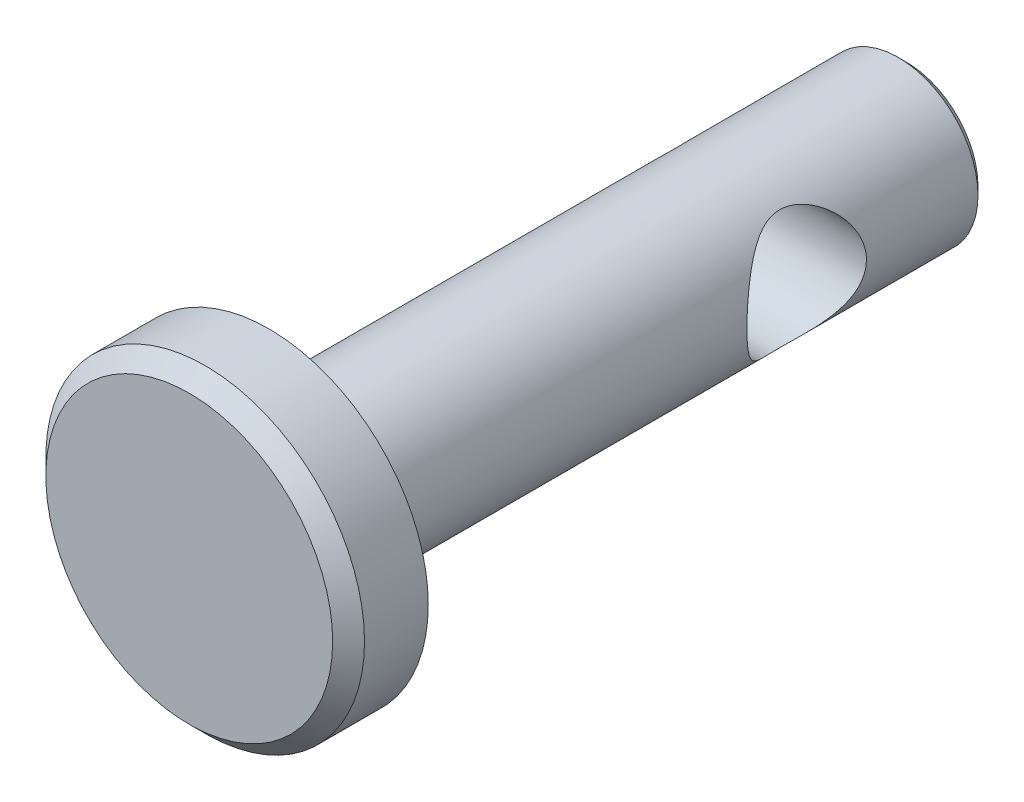
from build123d import *

# Parameters (mm, degrees)
SKETCH1_R           = 1.5875
EXTRUDE1_DEPTH      = 6.35
SKETCH2_R           = 3.175
EXTRUDE2_DEPTH      = 1.5875
CHAMFER1_SIZE       = 0.3175
EXTRUDE3_DEPTH      = 10.119493201
EXTRUDE3_DEPTH_BACK = 10.119493201
SKETCH3_R           = 1.190625
CHAMFER2_SIZE       = 0.15875


with BuildPart() as part:
    # Sketch1 → Extrude1 (new, symmetric)
    with BuildSketch(Plane.XY):
        Circle(SKETCH1_R)
    extrude(amount=EXTRUDE1_DEPTH, both=True)

    # Sketch2 → Extrude2 (add)
    with BuildSketch(Plane.XY.offset(6.35)):
        Circle(SKETCH2_R)
    extrude(amount=EXTRUDE2_DEPTH)

    # Chamfer1
    chamfer1_edges = [part.edges().sort_by_distance(p)[0] for p in [
        (-3.175, 0, 7.9375),
    ]]
    chamfer(chamfer1_edges, length=CHAMFER1_SIZE)

    # Sketch3 → Extrude3 (cut, two sides: drawn at the far end of the back side and taken through both)
    with BuildSketch(Plane(origin=(0, 0, 0), x_dir=(0, 0, -1), z_dir=(1, 0, 0)).offset(-EXTRUDE3_DEPTH_BACK)):
        with Locations(Location((2.778125, 0, 0), (0, 0, 180))):
            Circle(SKETCH3_R)
    extrude(amount=EXTRUDE3_DEPTH + EXTRUDE3_DEPTH_BACK, mode=Mode.SUBTRACT)

    # Chamfer2
    chamfer2_edges = [part.edges().sort_by_distance(p)[0] for p in [
        (-1.5875, 0, -6.35),
    ]]
    chamfer(chamfer2_edges, length=CHAMFER2_SIZE)


solid = part.part
